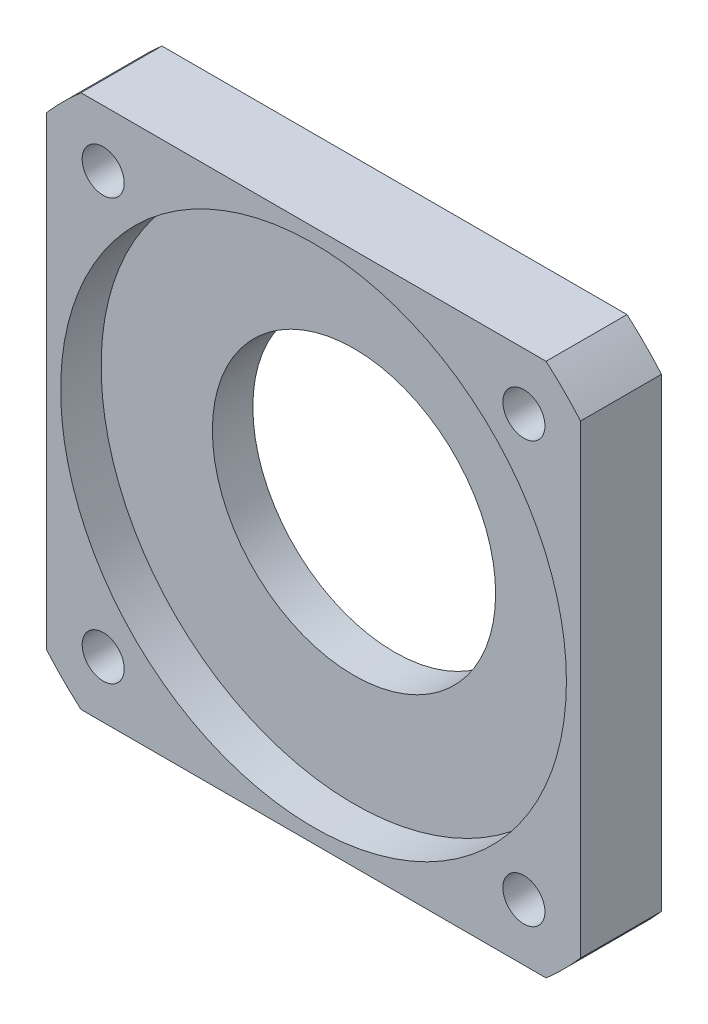
from build123d import *

# Parameters (mm, degrees)
SKETCH1_W           = 41.91
SKETCH1_H           = 41.91
SKETCH1_R           = 1.64973
SKETCH1_R_2         = 11.1125
BOSS_EXTRUDE1_DEPTH = 6.35
SKETCH2_R           = 62.565718238
SKETCH2_R_2         = 27.7876
CUT_EXTRUDE1_DEPTH  = 60.60888105
SKETCH3_R           = 19.84375
CUT_EXTRUDE2_DEPTH  = 3.175


with BuildPart() as part:
    # Sketch1 → Boss-Extrude1 (new body)
    with BuildSketch(Plane.XY):
        with Locations((20.955, 20.955)):
            Rectangle(SKETCH1_W, SKETCH1_H)
        with Locations((37.460710751, 37.460710751)):
            Circle(SKETCH1_R, mode=Mode.SUBTRACT)
        with Locations((37.460710751, 4.449289249)):
            Circle(SKETCH1_R, mode=Mode.SUBTRACT)
        with Locations((4.449289249, 4.449289249)):
            Circle(SKETCH1_R, mode=Mode.SUBTRACT)
        with Locations((4.449289249, 37.460710751)):
            Circle(SKETCH1_R, mode=Mode.SUBTRACT)
        with Locations((20.955, 20.955)):
            Circle(SKETCH1_R_2, mode=Mode.SUBTRACT)
    extrude(amount=BOSS_EXTRUDE1_DEPTH)

    # Sketch2 → Cut-Extrude1 (cut, through all)
    with BuildSketch(Plane.XY.offset(6.35)):
        with Locations((20.955, 20.955)):
            Circle(SKETCH2_R)
        with Locations((20.955, 20.955)):
            Circle(SKETCH2_R_2, mode=Mode.SUBTRACT)
    extrude(amount=-CUT_EXTRUDE1_DEPTH, mode=Mode.SUBTRACT)

    # Sketch3 → Cut-Extrude2 (cut)
    with BuildSketch(Plane.XY.offset(6.35)):
        with Locations((20.955, 20.955)):
            Circle(SKETCH3_R)
    extrude(amount=-CUT_EXTRUDE2_DEPTH, mode=Mode.SUBTRACT)


solid = part.part
